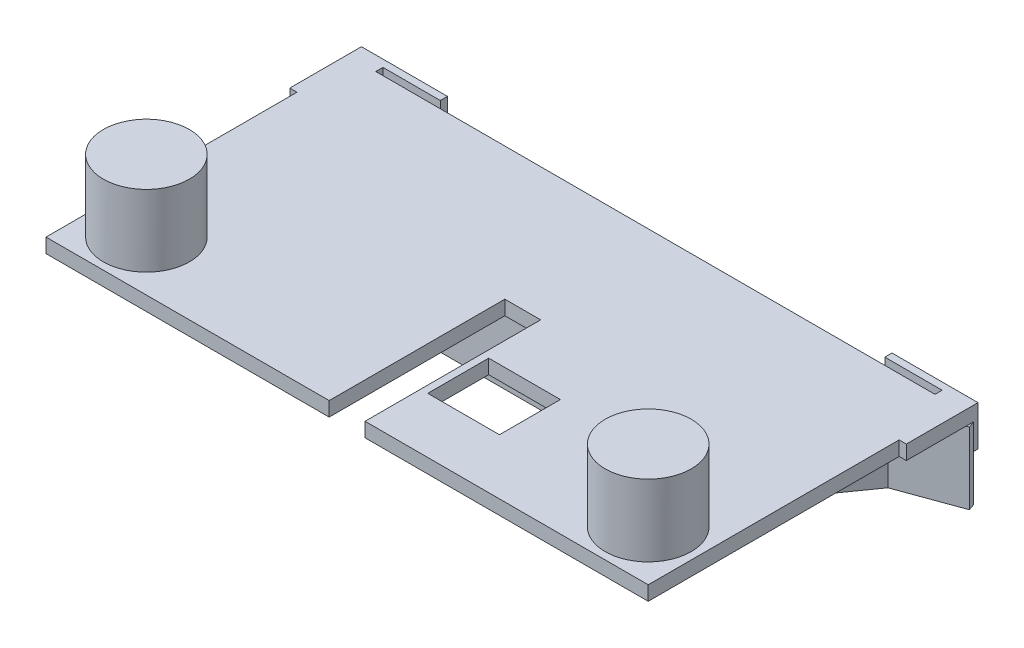
from build123d import *

# Parameters (mm, degrees)
SKETCH1_W           = 546.1
SKETCH1_H           = 279.4
BOSS_EXTRUDE1_DEPTH = 6.35
SKETCH2_W           = 31.75
SKETCH2_H           = 155.575
SKETCH2_W_2         = 6.35
SKETCH2_H_2         = 222.25
SKETCH2_W_3         = 63.5
SKETCH2_H_3         = 53.975
SKETCH2_W_4         = 495.3
SKETCH2_H_4         = 6.35
CUT_EXTRUDE1_DEPTH  = 307.975051918
EXTRUDE2_DEPTH      = 63.5
SKETCH4_R           = 38.1
BOSS_EXTRUDE2_DEPTH = 63.5
SKETCH5_W           = 76.2
SKETCH5_H           = 35.56
BOSS_EXTRUDE3_DEPTH = 6.35


with BuildPart() as part:
    # Sketch1 → Boss-Extrude1 (new, symmetric)
    with BuildSketch(Plane(origin=(0, 0, 0), x_dir=(1, 0, 0), z_dir=(0, 1, 0))):
        Rectangle(SKETCH1_W, SKETCH1_H)
    extrude(amount=BOSS_EXTRUDE1_DEPTH, both=True)

    # Sketch2 → Cut-Extrude1 (cut, through all)
    with BuildSketch(Plane(origin=(0, 6.35, 0), x_dir=(1, 0, 0), z_dir=(0, 1, 0))):
        with Locations((0, -61.9125)):
            Rectangle(SKETCH2_W, SKETCH2_H)
        with Locations((-269.875, -28.575)):
            Rectangle(SKETCH2_W_2, SKETCH2_H_2)
        with Locations((53.975, -63.5)):
            Rectangle(SKETCH2_W_3, SKETCH2_H_3)
        with Locations((0, 136.525)):
            Rectangle(SKETCH2_W_4, SKETCH2_H_4)
        with Locations((269.875, -28.575)):
            Rectangle(SKETCH2_W_2, SKETCH2_H_2)
    extrude(amount=-CUT_EXTRUDE1_DEPTH, mode=Mode.SUBTRACT)

    # Sketch3 → Extrude2 (add)
    with BuildSketch(Plane.XZ.offset(6.35)):
        Polygon((222.25, -116.992783244), (155.686970507, -22.86), (-155.686970507, -22.86), (-222.25, -116.992783244), (-275.22182791, -136.272951858), (-273.05, -142.24), (-218.211919626, -122.28057104), (-152.4, -29.21), (152.4, -29.21), (218.211919626, -122.28057104), (273.05, -142.24), (275.22182791, -136.272951858), align=None)
    extrude(amount=EXTRUDE2_DEPTH)

    # Sketch4 → Boss-Extrude2 (add)
    with BuildSketch(Plane(origin=(0, 6.35, 0), x_dir=(1, 0, 0), z_dir=(0, 1, 0))):
        with Locations(Location((222.25, -95.25, 0), (0, 0, 90))):
            Circle(SKETCH4_R)
        with Locations(Location((-222.25, -95.25, 0), (0, 0, 90))):
            Circle(SKETCH4_R)
    extrude(amount=BOSS_EXTRUDE2_DEPTH)

    # Sketch5 → Boss-Extrude3 (add)
    with BuildSketch(Plane(origin=(0, 0, -139.7), x_dir=(-1, 0, 0), z_dir=(0, 0, -1))):
        with Locations((-234.95, -11.43)):
            Rectangle(SKETCH5_W, SKETCH5_H)
        with Locations((234.95, -11.43)):
            Rectangle(SKETCH5_W, SKETCH5_H)
    extrude(amount=BOSS_EXTRUDE3_DEPTH)


solid = part.part
